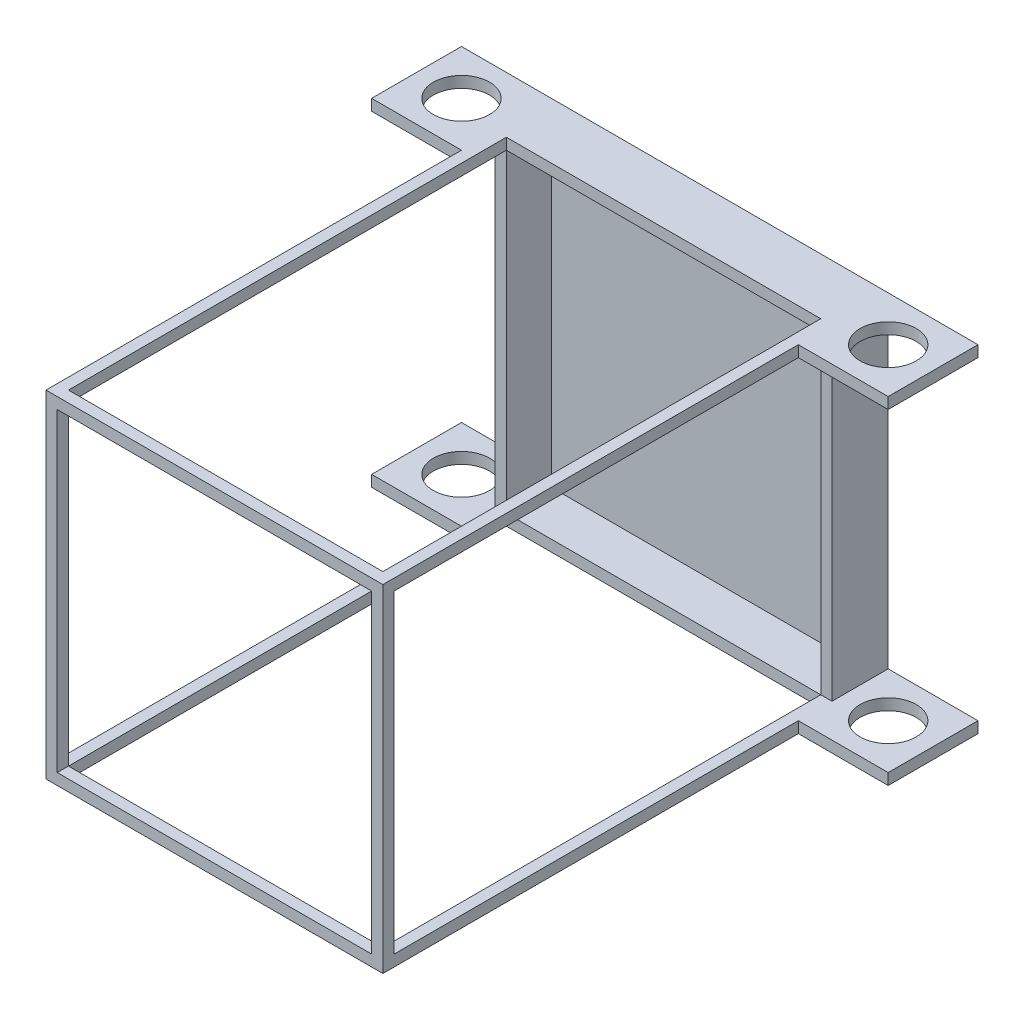
from build123d import *

# Parameters (mm, degrees)
SKETCH_1_W                  = 140
SKETCH_1_H                  = 140
EXTRUDE_2_DEPTH             = 5
SKETCH_1_4_W                = 40
SKETCH_1_4_H                = 5
EXTRUDE_3_DEPTH             = 20
SKETCH_2_R                  = 12.5
CUT_EXTRUDE_1_DEPTH         = 243.89915603
PATTERN_LINEAR_1_COUNT      = 2
PATTERN_LINEAR_1_PITCH      = 190
SKETCH_4_W                  = 5
SKETCH_4_H                  = 5
EXTRUDE_5_DEPTH             = 200
PATTERN_LINEAR_2_COUNT      = 2
PATTERN_LINEAR_2_PITCH      = 145
PATTERN_LINEAR_2_COUNT_DIR2 = 2
PATTERN_LINEAR_2_PITCH_DIR2 = 145
PATTERN_LINEAR_3_COUNT      = 2
PATTERN_LINEAR_3_PITCH      = 200
SKETCH_5_W                  = 150
SKETCH_5_H                  = 150
EXTRUDE_6_DEPTH             = 20
SKETCH_7_W                  = 140
SKETCH_7_H                  = 140
CUT_EXTRUDE_3_DEPTH         = 15


with BuildPart() as part:
    # Эскиз1 → Бобышка-Вытянуть2 (new body)
    with BuildSketch(Plane.XY):
        Polygon((150, 150), (0, 150), (0, 145), (0, 5), (0, 0), (150, 0), (150, 5), (150, 145), align=None)
        with Locations((75, 75)):
            Rectangle(SKETCH_1_W, SKETCH_1_H, mode=Mode.SUBTRACT)
    extrude_2 = extrude(amount=EXTRUDE_2_DEPTH)

    # Эскиз1<4> → Бобышка-Вытянуть3 (add, symmetric)
    with BuildSketch(Plane.XY):
        with Locations((170, 147.5)):
            Rectangle(SKETCH_1_4_W, SKETCH_1_4_H)
        with Locations((-20, 147.5)):
            Rectangle(SKETCH_1_4_W, SKETCH_1_4_H)
        with Locations((170, 2.5)):
            Rectangle(SKETCH_1_4_W, SKETCH_1_4_H)
        with Locations((-20, 2.5)):
            Rectangle(SKETCH_1_4_W, SKETCH_1_4_H)
    extrude(amount=EXTRUDE_3_DEPTH, both=True)

    # Эскиз2 → Вырез-Вытянуть1 (cut, through all)
    with BuildSketch(Plane.XZ):
        with Locations((-20, 0)):
            Circle(SKETCH_2_R)
    cut_extrude_1 = extrude(amount=-CUT_EXTRUDE_1_DEPTH, mode=Mode.SUBTRACT)

    # Линейный массив1: Вырез-Вытянуть1 ×2
    with Locations(*[(i * PATTERN_LINEAR_1_PITCH, 0, 0) for i in range(1, PATTERN_LINEAR_1_COUNT)]):
        add(cut_extrude_1, mode=Mode.SUBTRACT)

    # Эскиз4 → Бобышка-Вытянуть5 (add)
    with BuildSketch(Plane.XY.offset(5)):
        with Locations((147.5, 2.5)):
            Rectangle(SKETCH_4_W, SKETCH_4_H)
    extrude_5 = extrude(amount=EXTRUDE_5_DEPTH)

    # Линейный массив2: Extrude 5 2 × 2
    with Locations(*[(-j * PATTERN_LINEAR_2_PITCH_DIR2, i * PATTERN_LINEAR_2_PITCH, 0) for i in range(PATTERN_LINEAR_2_COUNT) for j in range(PATTERN_LINEAR_2_COUNT_DIR2) if (i, j) != (0, 0)]):
        add(extrude_5)

    # Линейный массив3: Бобышка-Вытянуть2 ×2
    with Locations(*[(0, 0, i * PATTERN_LINEAR_3_PITCH) for i in range(1, PATTERN_LINEAR_3_COUNT)]):
        add(extrude_2)

    # Эскиз5 → Бобышка-Вытянуть6 (add)
    with BuildSketch(Plane(origin=(0, 0, 0), x_dir=(-1, 0, 0), z_dir=(0, 0, -1))):
        with Locations((-75, 75)):
            Rectangle(SKETCH_5_W, SKETCH_5_H)
    extrude(amount=EXTRUDE_6_DEPTH)

    # Эскиз7 → Вырез-Вытянуть3 (cut)
    with BuildSketch(Plane.XY):
        with Locations((75, 75)):
            Rectangle(SKETCH_7_W, SKETCH_7_H)
    extrude(amount=-CUT_EXTRUDE_3_DEPTH, mode=Mode.SUBTRACT)


solid = part.part
